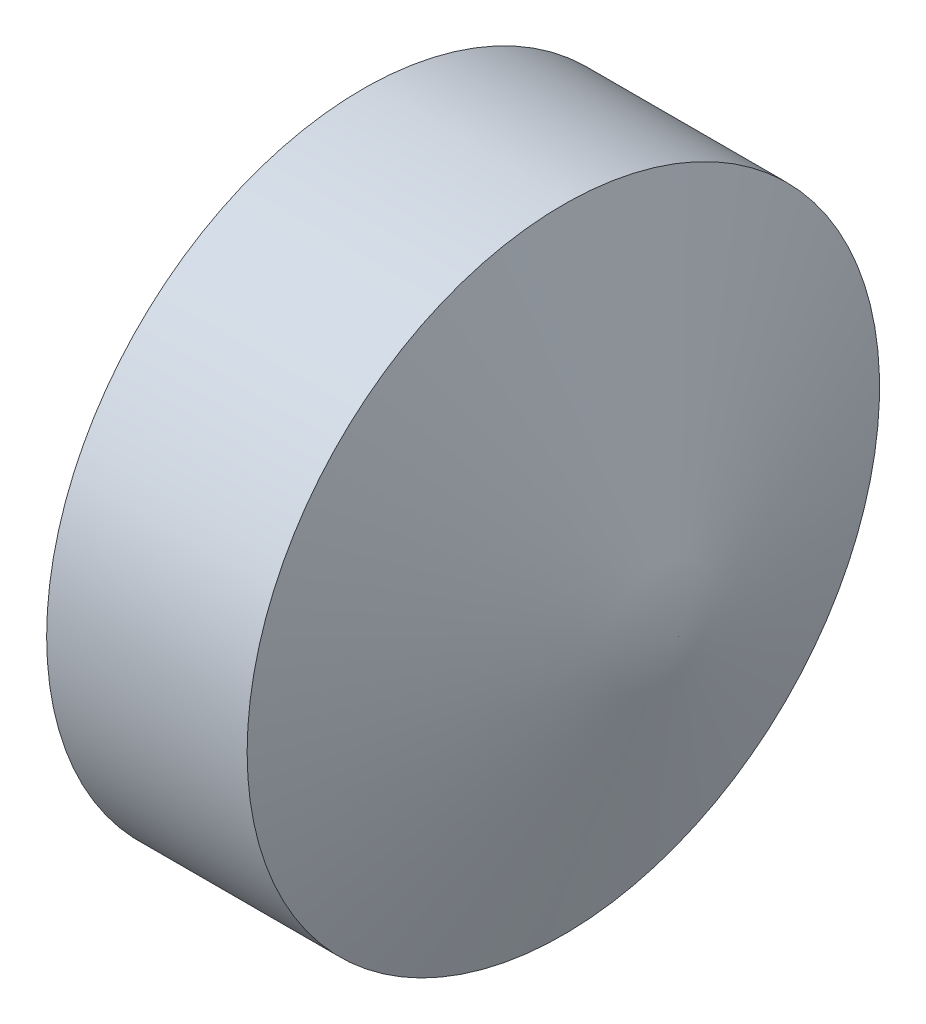
from build123d import *

# Parameters (mm, degrees)
CORTE_EXTRUS_O1_DEPTH = 1.2
CHANFRO1_SIZE         = 0.2535
CHANFRO1_SIZE2        = 0.146358293


with BuildPart() as part:
    # Esboço1 → Revolução1 (revolve)
    with BuildSketch(Plane(origin=(0, 0, 0), x_dir=(-1, 0, 0), z_dir=(0, 0, -1)), mode=Mode.PRIVATE) as revolu_o1_sk:
        Polygon((-2.506336445, 1.356329469), (-3, 0), (-1.5, 0), (-1.5, 1.356329469), align=None)
    revolve(revolu_o1_sk.sketch.rotate(Axis((3, 0, 0), (-1, 0, 0)), 270), axis=Axis((3, 0, 0), (-1, 0, 0)))

    # Esboço2 → Corte-extrusão1 (cut)
    with BuildSketch(Plane.ZY.offset(-1.5)):
        Polygon((0.375277675, -0.65), (0.75055535, 0), (0.375277675, 0.65), (-0.375277675, 0.65), (-0.75055535, 0), (-0.375277675, -0.65), align=None)
    extrude(amount=-CORTE_EXTRUS_O1_DEPTH, mode=Mode.SUBTRACT)

    # Chanfro1
    chanfro1_edges = [part.edges().sort_by_distance(p)[0] for p in [
        (1.5, 0, -1.356329469),
    ]]
    chanfro1_side = [part.faces().sort_by_distance(p)[0] for p in [
        (1.5, 0, -1.317966678),
    ]]
    chamfer(chanfro1_edges, length=CHANFRO1_SIZE, length2=CHANFRO1_SIZE2, reference=chanfro1_side[0])


solid = part.part
